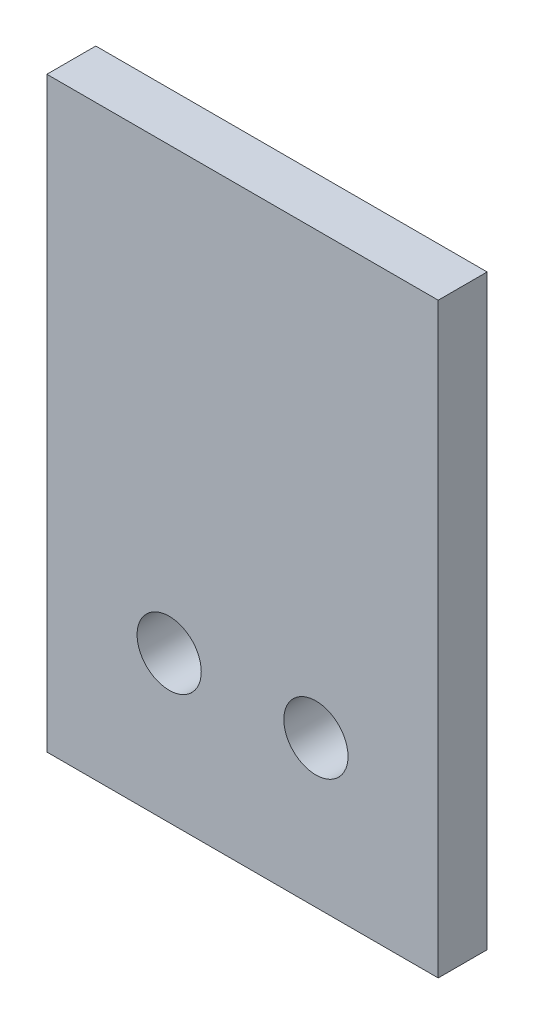
from build123d import *

# Parameters (mm, degrees)
SKETCH1_W           = 50.8
SKETCH1_H           = 76.2
SKETCH1_R           = 4.1656
BOSS_EXTRUDE1_DEPTH = 6.35


with BuildPart() as part:
    # Sketch1 → Boss-Extrude1 (new body)
    with BuildSketch(Plane.XY):
        with Locations((0, 38.1)):
            Rectangle(SKETCH1_W, SKETCH1_H)
        with Locations((9.525, 19.05)):
            Circle(SKETCH1_R, mode=Mode.SUBTRACT)
        with Locations((-9.525, 19.05)):
            Circle(SKETCH1_R, mode=Mode.SUBTRACT)
    extrude(amount=BOSS_EXTRUDE1_DEPTH)


solid = part.part
